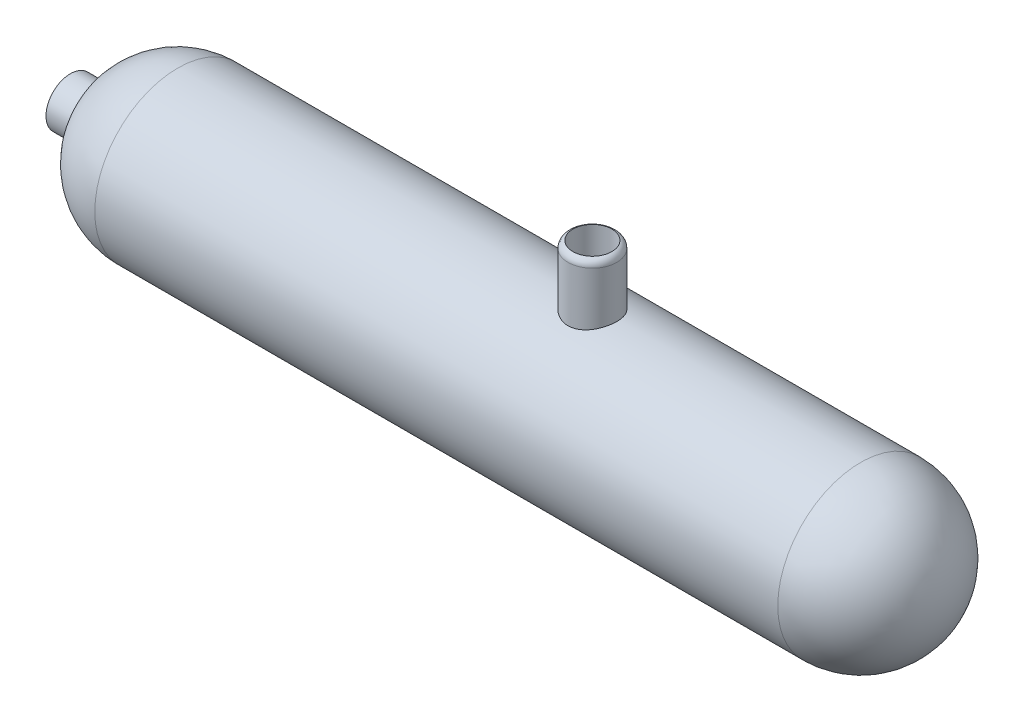
from build123d import *

# Parameters (mm, degrees)
BOSS_EXTRUDE1_DEPTH      = 1200
BOSS_EXTRUDE1_DEPTH_BACK = 100
SKETCH3_R                = 500
FILLET1_R                = 150
SKETCH4_R                = 1500
BOSS_EXTRUDE3_DEPTH      = 100
SKETCH5_R                = 1500
BOSS_EXTRUDE4_DEPTH      = 100
SKETCH6_R                = 1500
BOSS_EXTRUDE5_DEPTH      = 100
SKETCH7_R                = 1500
BOSS_EXTRUDE6_DEPTH      = 100
BOSS_EXTRUDE7_DEPTH      = 500
BOSS_EXTRUDE7_DEPTH_BACK = 120
SKETCH11_R               = 500
SKETCH12_R               = 400
CUT_EXTRUDE1_DEPTH       = 1746


with BuildPart() as part:
    # Sketch2 → Revolve2 (revolve)
    with BuildSketch(Plane.XY, mode=Mode.PRIVATE) as revolve2_sk:
        with BuildLine():
            Line((-7000, 1700), (7000, 1700))
            ThreePointArc((7000, 1700), (8202.081528017, 1202.081528017), (8700, 0))
            Line((8700, 0), (7000, 0))
            Line((7000, 0), (7000, 1500))
            Line((7000, 1500), (-7000, 1500))
            Line((-7000, 1500), (-7000, 0))
            Line((-7000, 0), (-8700, 0))
            ThreePointArc((-8700, 0), (-8202.081528017, 1202.081528017), (-7000, 1700))
        make_face()
    revolve(revolve2_sk.sketch.rotate(Axis((-7000, 0, 0), (1, 0, 0)), 90), axis=Axis((-7000, 0, 0), (1, 0, 0)))

    # Sketch3 → Boss-Extrude1 (add, two sides: drawn at the far end of the back side and taken through both)
    with BuildSketch(Plane(origin=(0, 1700, 0), x_dir=(1, 0, 0), z_dir=(0, 1, 0)).offset(-BOSS_EXTRUDE1_DEPTH_BACK)):
        with Locations(Location((1500, 0, 0), (0, 0, 270))):
            Circle(SKETCH3_R)
    extrude(amount=BOSS_EXTRUDE1_DEPTH + BOSS_EXTRUDE1_DEPTH_BACK)

    # Fillet1
    fillet1_edges = [part.edges().sort_by_distance(p)[0] for p in [
        (1500, 2900, -500),
    ]]
    fillet(fillet1_edges, radius=FILLET1_R)

    # Sketch4 → Boss-Extrude3 (add, symmetric)
    with BuildSketch(Plane(origin=(-3250, 0, 0), x_dir=(0, 0, -1), z_dir=(1, 0, 0))):
        with Locations(Location((0, 0, 0), (0, 0, 180))):
            Circle(SKETCH4_R)
    extrude(amount=BOSS_EXTRUDE3_DEPTH, both=True)

    # Sketch5 → Boss-Extrude4 (add, symmetric)
    with BuildSketch(Plane(origin=(-1750, 0, 0), x_dir=(0, 0, -1), z_dir=(1, 0, 0))):
        Circle(SKETCH5_R)
    extrude(amount=BOSS_EXTRUDE4_DEPTH, both=True)

    # Sketch6 → Boss-Extrude5 (add, symmetric)
    with BuildSketch(Plane(origin=(-4500, 0, 0), x_dir=(0, 0, -1), z_dir=(1, 0, 0))):
        with Locations(Location((0, 0, 0), (0, 0, 180))):
            Circle(SKETCH6_R)
    extrude(amount=BOSS_EXTRUDE5_DEPTH, both=True)

    # Sketch7 → Boss-Extrude6 (add, symmetric)
    with BuildSketch(Plane(origin=(4864.908043894, 0, 0), x_dir=(0, 0, -1), z_dir=(1, 0, 0))):
        Circle(SKETCH7_R)
    extrude(amount=BOSS_EXTRUDE6_DEPTH, both=True)

    # Sketch11 → Boss-Extrude7 (add, two sides: drawn at the far end of the back side and taken through both)
    with BuildSketch(Plane.ZY.offset(8700).offset(-BOSS_EXTRUDE7_DEPTH_BACK)):
        Circle(SKETCH11_R)
    extrude(amount=BOSS_EXTRUDE7_DEPTH + BOSS_EXTRUDE7_DEPTH_BACK)

    # Sketch12 → Cut-Extrude1 (cut)
    with BuildSketch(Plane(origin=(0, 2900, 0), x_dir=(1, 0, 0), z_dir=(0, 1, 0))):
        with Locations(Location((1500, 0, 0), (0, 0, 270))):
            Circle(SKETCH12_R)
    extrude(amount=-CUT_EXTRUDE1_DEPTH, mode=Mode.SUBTRACT)


solid = part.part
